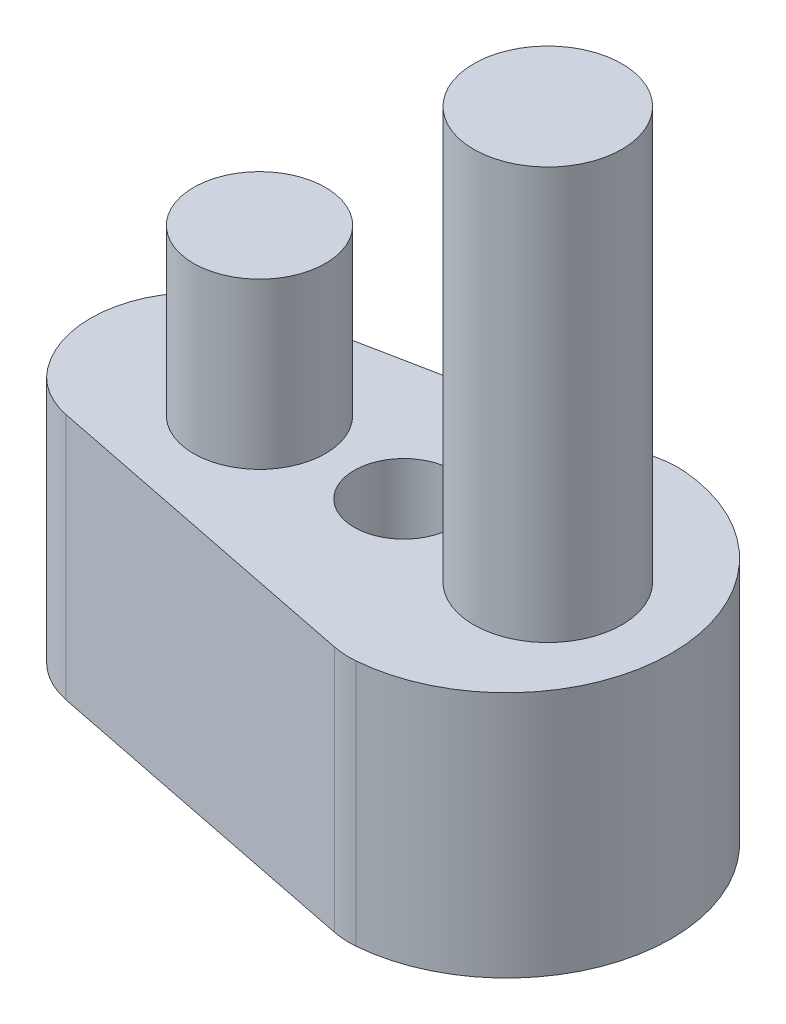
from build123d import *

# Parameters (mm, degrees)
SKETCH1_R           = 0.6
BOSS_EXTRUDE1_DEPTH = 3
SKETCH1_22_R        = 0.9
BOSS_EXTRUDE2_DEPTH = 8
SKETCH1_23_R        = 0.8
BOSS_EXTRUDE3_DEPTH = 5


with BuildPart() as part:
    # Sketch1 → Boss-Extrude1 (new body)
    with BuildSketch(Plane(origin=(0, 0, 0), x_dir=(1, 0, 0), z_dir=(0, 1, 0))):
        with BuildLine():
            ThreePointArc((0.1641009, 1.993256355), (0.024548565, 1.994973575), (-0.113883759, 1.977245221))
            Line((-0.113883759, 1.977245221), (-4.183235691, 1.164159973))
            ThreePointArc((-4.183235691, 1.164159973), (-4.514100231, 1.033532975), (-4.77830642, 0.795352694))
            ThreePointArc((-4.77830642, 0.795352694), (-5.05, 0), (-4.77830642, -0.795352694))
            ThreePointArc((-4.77830642, -0.795352694), (-4.514100231, -1.033532975), (-4.183235691, -1.164159973))
            Line((-4.183235691, -1.164159973), (-0.11388376, -1.977245221))
            ThreePointArc((-0.11388376, -1.977245221), (0.024548564, -1.994973575), (0.164100898, -1.993256355))
            ThreePointArc((0.164100898, -1.993256355), (2, -1e-09), (0.1641009, 1.993256355))
        make_face()
        with Locations((-1.25, 0)):
            Circle(SKETCH1_R, mode=Mode.SUBTRACT)
    extrude(amount=BOSS_EXTRUDE1_DEPTH)

    # Sketch1<22> → Boss-Extrude2 (add)
    with BuildSketch(Plane(origin=(0, 0, 0), x_dir=(1, 0, 0), z_dir=(0, 1, 0))):
        with Locations((0.5, 0)):
            Circle(SKETCH1_22_R)
    extrude(amount=BOSS_EXTRUDE2_DEPTH)

    # Sketch1<23> → Boss-Extrude3 (add)
    with BuildSketch(Plane(origin=(0, 0, 0), x_dir=(1, 0, 0), z_dir=(0, 1, 0))):
        with Locations((-3, 0)):
            Circle(SKETCH1_23_R)
    extrude(amount=BOSS_EXTRUDE3_DEPTH)


solid = part.part
